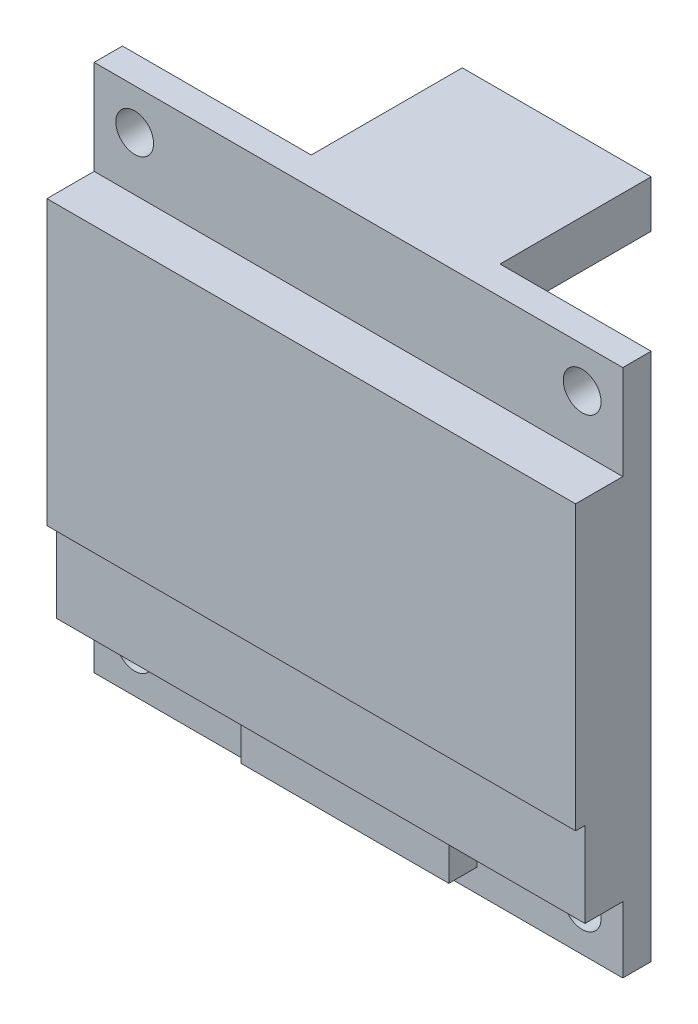
from build123d import *

# Parameters (mm, degrees)
SKETCH_1_W          = 28
SKETCH_1_H          = 28
EXTRUDE_3_DEPTH     = 1.5
SKETCH_3_W          = 28
SKETCH_3_H          = 19.5
EXTRUDE_4_DEPTH     = 2
SKETCH_5_W          = 28
SKETCH_5_H          = 15
EXTRUDE_5_DEPTH     = 0.5
SKETCH_6_W          = 11
SKETCH_6_H          = 2.266421477
EXTRUDE_6_DEPTH     = 1.5
SKETCH_7_R          = 1
CUT_EXTRUDE_4_DEPTH = 1.5
SKETCH_10_W         = 10
SKETCH_10_H         = 2.5
EXTRUDE_8_DEPTH     = 8


with BuildPart() as part:
    # Эскиз1 → Бобышка-Вытянуть3 (new body)
    with BuildSketch(Plane.XY):
        with Locations((14, 14)):
            Rectangle(SKETCH_1_W, SKETCH_1_H)
    extrude(amount=EXTRUDE_3_DEPTH)

    # Эскиз3 → Бобышка-Вытянуть4 (add)
    with BuildSketch(Plane.XY.offset(1.5)):
        with Locations((14, 13.25)):
            Rectangle(SKETCH_3_W, SKETCH_3_H)
    extrude(amount=EXTRUDE_4_DEPTH)

    # Эскиз5 → Бобышка-Вытянуть5 (add)
    with BuildSketch(Plane.XY.offset(3.5)):
        with Locations((14, 15.5)):
            Rectangle(SKETCH_5_W, SKETCH_5_H)
    extrude(amount=EXTRUDE_5_DEPTH)

    # Эскиз6 → Бобышка-Вытянуть6 (add)
    with BuildSketch(Plane.XY.offset(1.5)):
        with Locations((14.787482479, 2.366789262)):
            Rectangle(SKETCH_6_W, SKETCH_6_H)
    extrude(amount=EXTRUDE_6_DEPTH)

    # Эскиз7 → Вырез-Вытянуть4 (cut)
    with BuildSketch(Plane.XY.offset(1.5)):
        with Locations((2.15, 2.15)):
            Circle(SKETCH_7_R)
        with Locations((2.15, 25.85)):
            Circle(SKETCH_7_R)
        with Locations((25.85, 25.85)):
            Circle(SKETCH_7_R)
        with Locations((25.85, 2.15)):
            Circle(SKETCH_7_R)
    extrude(amount=-CUT_EXTRUDE_4_DEPTH, mode=Mode.SUBTRACT)

    # Эскиз10 → Бобышка-Вытянуть8 (add)
    with BuildSketch(Plane(origin=(0, 0, 0), x_dir=(-1, 0, 0), z_dir=(0, 0, -1))):
        with Locations((-15, 26.75)):
            Rectangle(SKETCH_10_W, SKETCH_10_H)
    extrude(amount=EXTRUDE_8_DEPTH)


solid = part.part
